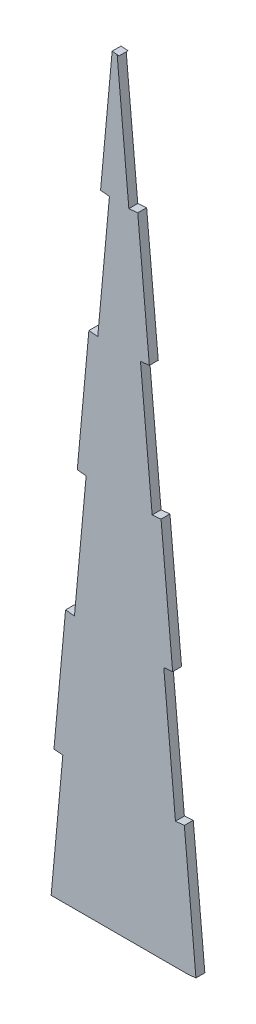
from build123d import *

# Parameters (mm, degrees)
BOSS_EXTRUDE1_DEPTH = 3


with BuildPart() as part:
    # Sketch1 → Boss-Extrude1 (new body)
    with BuildSketch(Plane.XY):
        Polygon((-0.65358299, 256.064124233), (0, 256.124180074), (-2.333831792, 256.338629089), (-6.241604492, 213.81064579), (-3.254189709, 213.536140934), (-7.189412895, 170.709416156), (-10.176827678, 170.983921012), (-14.084600378, 128.455937712), (-11.097185595, 128.181432856), (-15.03240878, 85.354708078), (-18.019823563, 85.629212934), (-21.927596263, 43.101229634), (-18.94018148, 42.826724778), (-22.875404666, 0), (22.875404666, 0), (25.862819449, 0.274504856), (21.955046749, 42.802488156), (18.967631966, 42.5279833), (15.03240878, 85.354708078), (18.019823563, 85.629212934), (14.112050863, 128.157196234), (11.12463608, 127.882691378), (7.189412895, 170.709416156), (10.176827678, 170.983921012), (6.269054978, 213.511904311), (3.281640195, 213.237399455), align=None)
    extrude(amount=BOSS_EXTRUDE1_DEPTH)


solid = part.part
